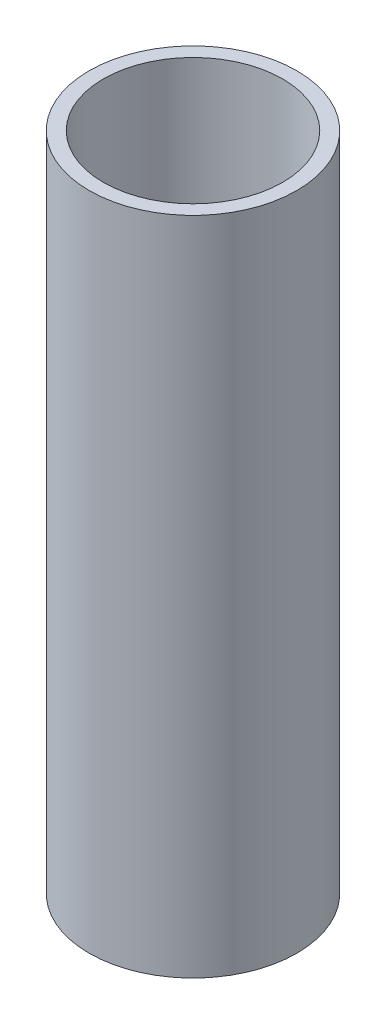
from build123d import *

# Parameters (mm, degrees)
SKETCH3_R           = 11
BOSS_EXTRUDE1_DEPTH = 70
SKETCH4_R           = 2.8
CUT_EXTRUDE1_DEPTH  = 70
SKETCH5_R           = 9.5
CUT_EXTRUDE2_DEPTH  = 33.5
CUT_EXTRUDE3_START  = -33.5
SKETCH6_R           = 9.5
CUT_EXTRUDE3_DEPTH  = 33.5


with BuildPart() as part:
    # Sketch3 → Boss-Extrude1 (new body)
    with BuildSketch(Plane(origin=(0, 0, 0), x_dir=(1, 0, 0), z_dir=(0, 1, 0))):
        with Locations(Location((0, 0, 0), (0, 0, 270))):
            Circle(SKETCH3_R)
    extrude(amount=BOSS_EXTRUDE1_DEPTH)

    # Sketch4 → Cut-Extrude1 (cut)
    with BuildSketch(Plane(origin=(0, 70, 0), x_dir=(1, 0, 0), z_dir=(0, 1, 0))):
        with Locations(Location((0, 0, 0), (0, 0, 270))):
            Circle(SKETCH4_R)
    extrude(amount=-CUT_EXTRUDE1_DEPTH, mode=Mode.SUBTRACT)

    # Sketch5 → Cut-Extrude2 (cut)
    with BuildSketch(Plane(origin=(0, 0, 0), x_dir=(-1, 0, 0), z_dir=(0, -1, 0))):
        with Locations(Location((0, 0, 0), (0, 0, 90))):
            Circle(SKETCH5_R)
    extrude(amount=-CUT_EXTRUDE2_DEPTH, mode=Mode.SUBTRACT)

    # Sketch6 → Cut-Extrude3 (cut)
    with BuildSketch(Plane(origin=(0, 70, 0), x_dir=(1, 0, 0), z_dir=(0, 1, 0)).offset(CUT_EXTRUDE3_START)):
        with Locations(Location((0, 0, 0), (0, 0, 90))):
            Circle(SKETCH6_R)
    extrude(amount=CUT_EXTRUDE3_DEPTH, mode=Mode.SUBTRACT)


solid = part.part
